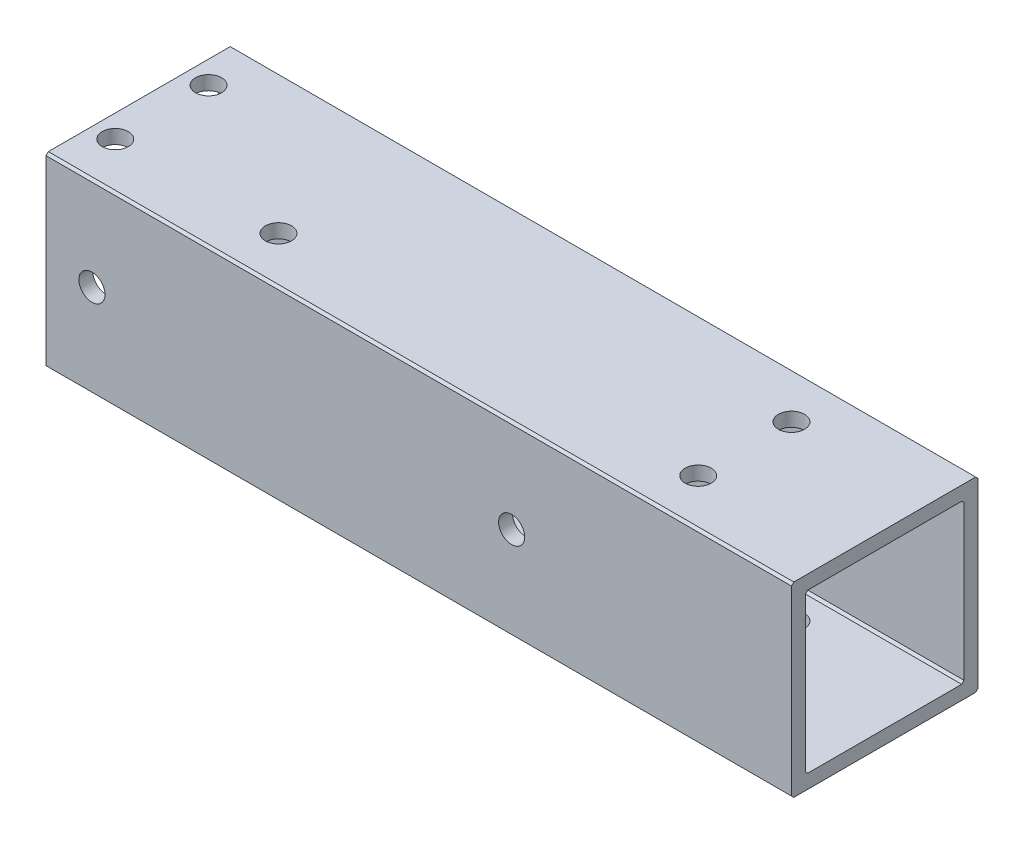
from build123d import *

# Parameters (mm, degrees)
SKETCH1_W                      = 159.85
SKETCH1_H                      = 40
BOSS_EXTRUDE1_DEPTH            = 40
SKETCH2_W                      = 34
SKETCH2_H                      = 34
CUT_EXTRUDE1_DEPTH             = 256.569995305
F_5_6_5_6_DIAMETER_HOLE1_D     = 5.6
F_5_6_5_6_DIAMETER_HOLE1_DEPTH = 3
F_5_6_5_6_DIAMETER_HOLE2_D     = 5.6
F_5_6_5_6_DIAMETER_HOLE2_DEPTH = 3
F_5_6_5_6_DIAMETER_HOLE3_D     = 5.6
F_5_6_5_6_DIAMETER_HOLE4_D     = 5.6
F_5_6_5_6_DIAMETER_HOLE4_DEPTH = 40
CHAMFER1_SIZE                  = 0.5


with BuildPart() as part:
    # Sketch1 → Boss-Extrude1 (new body)
    with BuildSketch(Plane(origin=(0, 142, 0), x_dir=(1, 0, 0), z_dir=(0, 1, 0))):
        with Locations((170.075, -120)):
            Rectangle(SKETCH1_W, SKETCH1_H)
    extrude(amount=-BOSS_EXTRUDE1_DEPTH)

    # Sketch2 → Cut-Extrude1 (cut, through all)
    with BuildSketch(Plane.ZY.offset(-90.15)):
        with Locations((120, 122)):
            Rectangle(SKETCH2_W, SKETCH2_H)
    extrude(amount=-CUT_EXTRUDE1_DEPTH, mode=Mode.SUBTRACT)

    # Ø5.6 (5.6) Diameter Hole1
    with Locations(Plane(origin=(0, 105, 0), x_dir=(1, 0, 0), z_dir=(0, 1, 0))):
        with Locations((220, -130), (220, -110), (130, -130), (95, -130), (95, -110)):
            Hole(F_5_6_5_6_DIAMETER_HOLE1_D / 2, depth=F_5_6_5_6_DIAMETER_HOLE1_DEPTH)

    # Ø5.6 (5.6) Diameter Hole2
    with Locations(Plane(origin=(0, 0, 100), x_dir=(-1, 0, 0), z_dir=(0, 0, -1))):
        with Locations((-190, 122), (-100, 122)):
            Hole(F_5_6_5_6_DIAMETER_HOLE2_D / 2, depth=F_5_6_5_6_DIAMETER_HOLE2_DEPTH)

    # Ø5.6 (5.6) Diameter Hole3 (through all)
    with Locations(Plane(origin=(0, 0, 137), x_dir=(-1, 0, 0), z_dir=(0, 0, -1))):
        with Locations((-190, 122), (-100, 122)):
            Hole(F_5_6_5_6_DIAMETER_HOLE3_D / 2)

    # Ø5.6 (5.6) Diameter Hole4
    with Locations(Plane(origin=(0, 142, 0), x_dir=(1, 0, 0), z_dir=(0, 1, 0))):
        with Locations((220, -130), (220, -110), (130, -130), (95, -130), (95, -110)):
            Hole(F_5_6_5_6_DIAMETER_HOLE4_D / 2, depth=F_5_6_5_6_DIAMETER_HOLE4_DEPTH)

    # Chamfer1
    chamfer1_edges = [part.edges().sort_by_distance(p)[0] for p in [
        (170.075, 102, 100),
        (170.075, 105, 103),
        (170.075, 139, 103),
        (170.075, 139, 137),
        (170.075, 105, 137),
        (170.075, 102, 140),
        (170.075, 142, 100),
        (170.075, 142, 140),
    ]]
    chamfer(chamfer1_edges, length=CHAMFER1_SIZE)


solid = part.part
